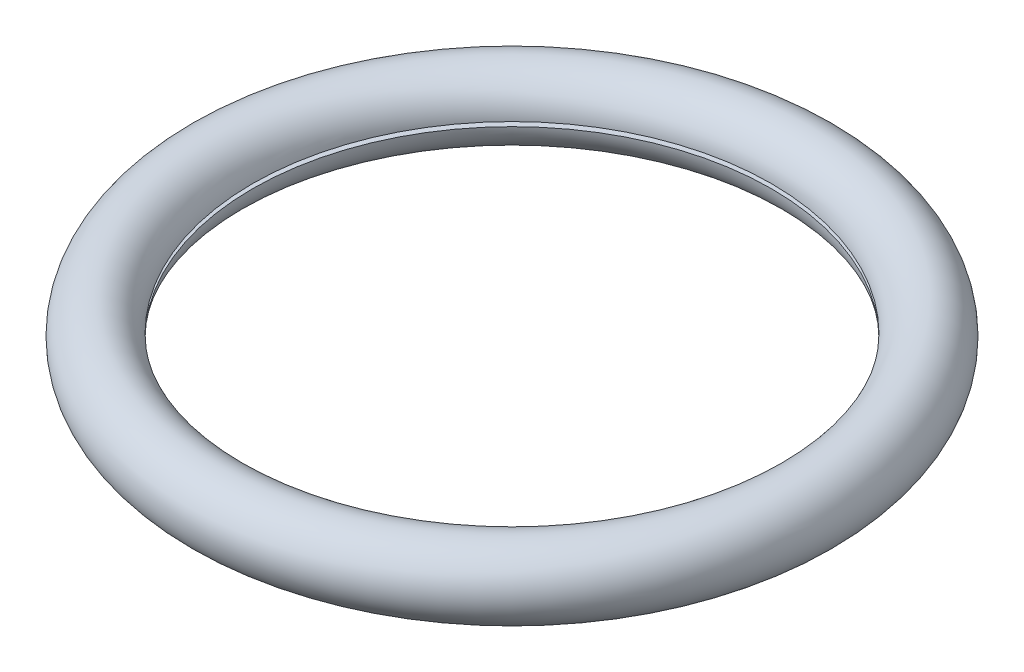
from build123d import *


with BuildPart() as part:
    # Sketch1 → Revolve2 (revolve)
    with BuildSketch(Plane.XY, mode=Mode.PRIVATE) as revolve2_sk:
        with BuildLine():
            Line((164.466296053, -2.376580105), (150.407726333, -2.376580105))
            ThreePointArc((150.407726333, -2.376580105), (191.008, -3.646580105), (150.407726333, -4.916580105))
            Line((150.407726333, -4.916580105), (164.466296053, -4.916580105))
            ThreePointArc((164.466296053, -4.916580105), (177.038, -3.646580105), (164.466296053, -2.376580105))
        make_face()
    revolve(revolve2_sk.sketch.rotate(Axis((0, 65.671776781, 0), (0, -1, 0)), 90), axis=Axis((0, 65.671776781, 0), (0, -1, 0)))


solid = part.part
